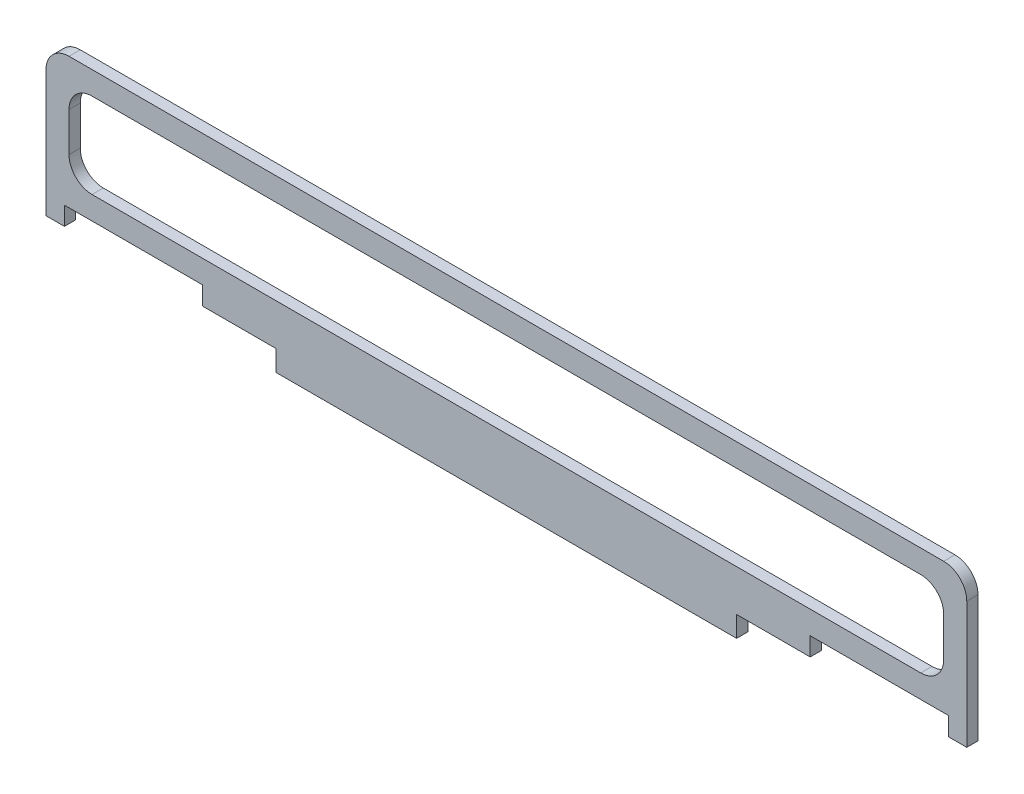
from build123d import *

# Parameters (mm, degrees)
SKETCH1_W           = 254
SKETCH1_H           = 46.99
BOSS_EXTRUDE1_DEPTH = 3.0988
FILLET1_R           = 6.35
SKETCH2_W           = 63.5
SKETCH2_H           = 5.715
CUT_EXTRUDE1_DEPTH  = 130.192173085
SKETCH3_W           = 38.1
SKETCH3_H           = 5.08
CUT_EXTRUDE2_DEPTH  = 130.192173085
CUT_EXTRUDE3_DEPTH  = 130.192173085
FILLET2_R           = 6.35


with BuildPart() as part:
    # Sketch1 → Boss-Extrude1 (new body)
    with BuildSketch(Plane.XY):
        Rectangle(SKETCH1_W, SKETCH1_H)
    extrude(amount=BOSS_EXTRUDE1_DEPTH)

    # Fillet1
    fillet1_edges = [part.edges().sort_by_distance(p)[0] for p in [
        (-127, 23.495, 1.5494),
        (127, 23.495, 1.5494),
    ]]
    fillet(fillet1_edges, radius=FILLET1_R)

    # Sketch2 → Cut-Extrude1 (cut, through all)
    with BuildSketch(Plane.XY.offset(3.0988)):
        with Locations((-95.25, -20.6375)):
            Rectangle(SKETCH2_W, SKETCH2_H)
        with Locations((95.25, -20.6375)):
            Rectangle(SKETCH2_W, SKETCH2_H)
    extrude(amount=-CUT_EXTRUDE1_DEPTH, mode=Mode.SUBTRACT)

    # Sketch3 → Cut-Extrude2 (cut, through all)
    with BuildSketch(Plane.XY.offset(3.0988)):
        with Locations((-102.87, -15.24)):
            Rectangle(SKETCH3_W, SKETCH3_H)
        with Locations((102.87, -15.24)):
            Rectangle(SKETCH3_W, SKETCH3_H)
    extrude(amount=-CUT_EXTRUDE2_DEPTH, mode=Mode.SUBTRACT)

    # Sketch4 → Cut-Extrude3 (cut, through all)
    with BuildSketch(Plane.XY.offset(3.0988)):
        Polygon((-77.47, -6.35), (77.47, -6.35), (120.65, -6.35), (120.65, 17.145), (-120.65, 17.145), (-120.65, -6.35), align=None)
    extrude(amount=-CUT_EXTRUDE3_DEPTH, mode=Mode.SUBTRACT)

    # Fillet2
    fillet2_edges = [part.edges().sort_by_distance(p)[0] for p in [
        (-120.65, 17.145, 1.5494),
        (120.65, 17.145, 1.5494),
        (120.65, -6.35, 1.5494),
        (-120.65, -6.35, 1.5494),
    ]]
    fillet(fillet2_edges, radius=FILLET2_R)


solid = part.part
